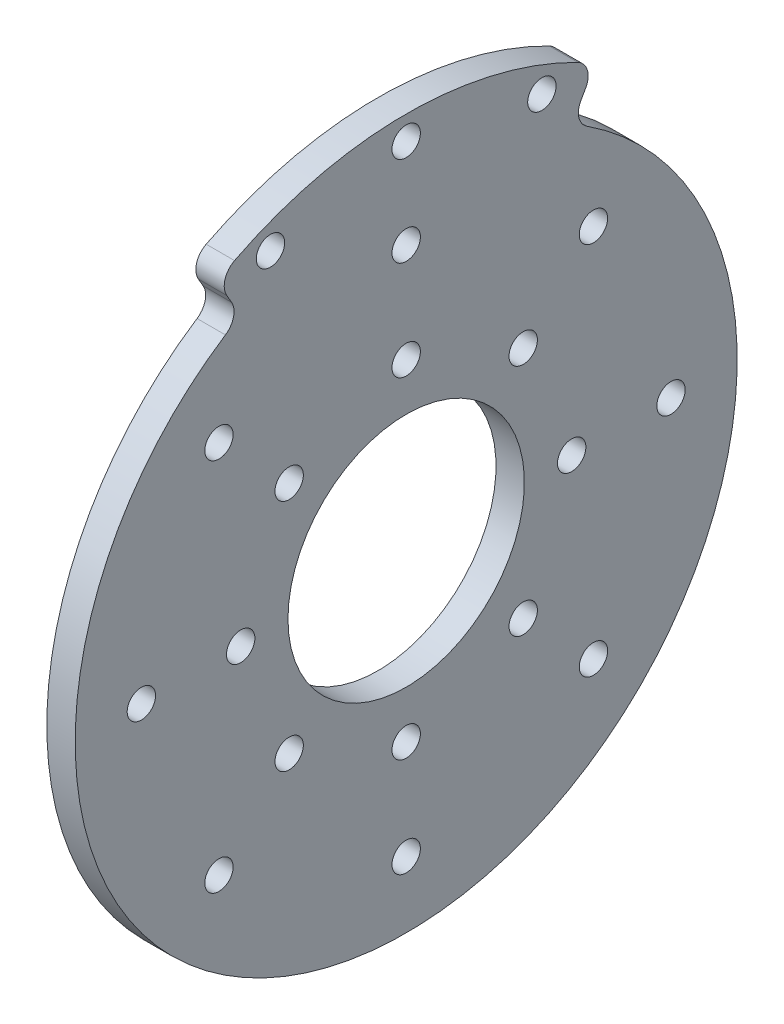
from build123d import *

# Parameters (mm, degrees)
SKETCH_1_R          = 35
EXTRUDE_1_DEPTH     = 3
SKETCH_2_R          = 1.5
CUT_EXTRUDE_1_DEPTH = 3
SKETCH_3_R          = 1.5
CUT_EXTRUDE_2_DEPTH = 3
SKETCH_4_R          = 12.5
CUT_EXTRUDE_3_DEPTH = 3
EXTRUDE_START       = -3
EXTRUDE_4_DEPTH     = 3
FILLET_1_R          = 2
FILLET_2_R          = 2
FILLET_3_R          = 2
FILLET_4_R          = 2
SKETCH_6_R          = 1.5
CUT_EXTRUDE_4_DEPTH = 3


with BuildPart() as part:
    # 草图1 → 凸台-拉伸1 (new body)
    with BuildSketch(Plane(origin=(0, 0, 0), x_dir=(0, 0, -1), z_dir=(1, 0, 0))):
        Circle(SKETCH_1_R)
    extrude(amount=EXTRUDE_1_DEPTH)

    # 草图2 → 切除-拉伸1 (cut)
    with BuildSketch(Plane(origin=(3, 0, 0), x_dir=(0, 0, -1), z_dir=(1, 0, 0))):
        with Locations((0, 28)):
            Circle(SKETCH_2_R)
        with Locations((19.798989873, 19.798989873)):
            Circle(SKETCH_2_R)
        with Locations((28, 0)):
            Circle(SKETCH_2_R)
        with Locations((19.798989873, -19.798989873)):
            Circle(SKETCH_2_R)
        with Locations((0, -28)):
            Circle(SKETCH_2_R)
        with Locations((-19.798989873, -19.798989873)):
            Circle(SKETCH_2_R)
        with Locations((-28, 0)):
            Circle(SKETCH_2_R)
        with Locations((-19.798989873, 19.798989873)):
            Circle(SKETCH_2_R)
    extrude(amount=-CUT_EXTRUDE_1_DEPTH, mode=Mode.SUBTRACT)

    # 草图3 → 切除-拉伸2 (cut)
    with BuildSketch(Plane(origin=(3, 0, 0), x_dir=(0, 0, -1), z_dir=(1, 0, 0))):
        with Locations((0, 17.5)):
            Circle(SKETCH_3_R)
        with Locations((12.374368671, 12.374368671)):
            Circle(SKETCH_3_R)
        with Locations((17.5, 0)):
            Circle(SKETCH_3_R)
        with Locations((12.374368671, -12.374368671)):
            Circle(SKETCH_3_R)
        with Locations((0, -17.5)):
            Circle(SKETCH_3_R)
        with Locations((-12.374368671, -12.374368671)):
            Circle(SKETCH_3_R)
        with Locations((-17.5, 0)):
            Circle(SKETCH_3_R)
        with Locations((-12.374368671, 12.374368671)):
            Circle(SKETCH_3_R)
    extrude(amount=-CUT_EXTRUDE_2_DEPTH, mode=Mode.SUBTRACT)

    # 草图4 → 切除-拉伸3 (cut)
    with BuildSketch(Plane.ZY):
        Circle(SKETCH_4_R)
    extrude(amount=-CUT_EXTRUDE_3_DEPTH, mode=Mode.SUBTRACT)

    # 草图5 → 凸台-拉伸4 (add)
    with BuildSketch(Plane(origin=(3, 0, 0), x_dir=(0, 0, -1), z_dir=(1, 0, 0)).offset(EXTRUDE_START)):
        with BuildLine():
            Line((-20, 34.641016151), (-17.5, 30.310889132))
            ThreePointArc((-17.5, 30.310889132), (-9.058666579, 33.80740392), (0, 35))
            Line((0, 35), (0, 40))
            ThreePointArc((0, 40), (-10.352761804, 38.637033052), (-20, 34.641016151))
        make_face()
        with BuildLine():
            ThreePointArc((0, 35), (9.058666579, 33.80740392), (17.5, 30.310889132))
            Line((17.5, 30.310889132), (20, 34.641016151))
            ThreePointArc((20, 34.641016151), (10.352761804, 38.637033052), (0, 40))
            Line((0, 40), (0, 35))
        make_face()
    extrude(amount=EXTRUDE_4_DEPTH)

    # 圆角1
    fillet_1_edges = [part.edges().sort_by_distance(p)[0] for p in [
        (1.5, 34.641016151, 20),
    ]]
    fillet(fillet_1_edges, radius=FILLET_1_R)

    # 圆角2
    fillet_2_edges = [part.edges().sort_by_distance(p)[0] for p in [
        (1.5, 30.310889132, 17.5),
    ]]
    fillet(fillet_2_edges, radius=FILLET_2_R)

    # 圆角3
    fillet_3_edges = [part.edges().sort_by_distance(p)[0] for p in [
        (1.5, 30.310889132, -17.5),
    ]]
    fillet(fillet_3_edges, radius=FILLET_3_R)

    # 圆角4
    fillet_4_edges = [part.edges().sort_by_distance(p)[0] for p in [
        (1.5, 34.641016151, -20),
    ]]
    fillet(fillet_4_edges, radius=FILLET_4_R)

    # 草图6 → 切除-拉伸4 (cut)
    with BuildSketch(Plane(origin=(3, 0, 0), x_dir=(0, 0, -1), z_dir=(1, 0, 0))):
        with Locations((0, 37.5)):
            Circle(SKETCH_6_R)
        with Locations((14.350628714, 34.645482469)):
            Circle(SKETCH_6_R)
        with Locations((-14.350628714, 34.645482469)):
            Circle(SKETCH_6_R)
    extrude(amount=-CUT_EXTRUDE_4_DEPTH, mode=Mode.SUBTRACT)


solid = part.part
